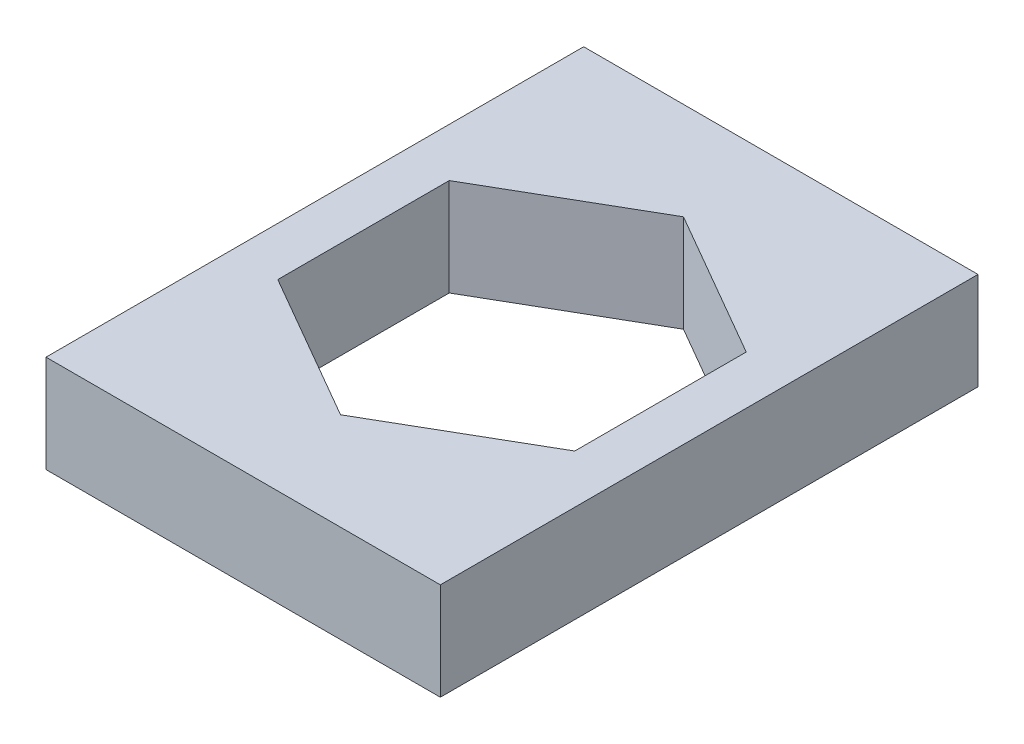
from build123d import *

# Parameters (mm, degrees)
EXTRUDE_1_DEPTH = 4


with BuildPart() as part:
    # 草图1 → 凸台-拉伸1 (new body)
    with BuildSketch(Plane(origin=(0, 0, 0), x_dir=(1, 0, 0), z_dir=(0, 1, 0))):
        Polygon((-8.1, 4.67653718), (-8.1, -4.67653718), (-8.1, -11.043673284), (8.1, -11.043673284), (8.1, -4.67653718), (8.1, 4.67653718), (8.1, 11.043673284), (-8.1, 11.043673284), align=None)
        Polygon((0, 7.043673284), (-6.1, 3.521836642), (-6.1, -3.521836642), (0, -7.043673284), (6.1, -3.521836642), (6.1, 3.521836642), align=None, mode=Mode.SUBTRACT)
    extrude(amount=EXTRUDE_1_DEPTH)


solid = part.part
